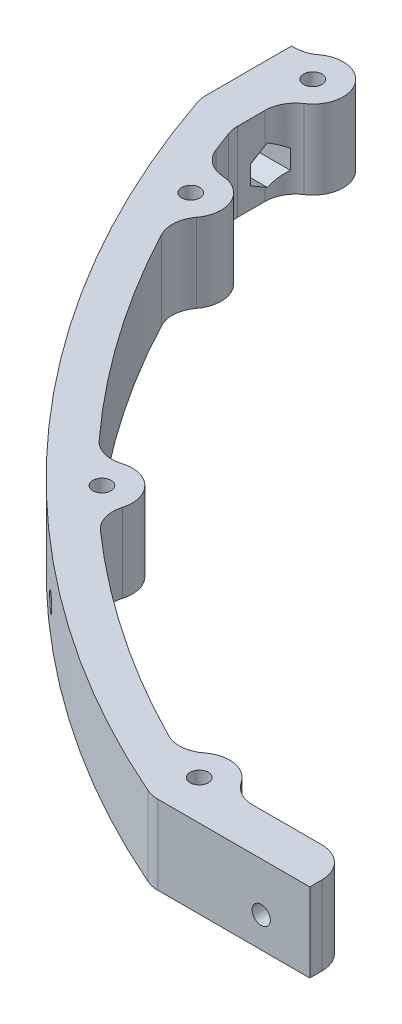
from build123d import *

# Parameters (mm, degrees)
BOSS_EXTRU_1_DEPTH           = 8
BOSS_EXTRU_1_DEPTH_BACK      = 5
ESQUISSE7_R                  = 1.5
ENL_V_MAT_EXTRU_5_DEPTH      = 231.204257128
ESQUISSE11_R                 = 1.5
ENL_V_MAT_EXTRU_9_DEPTH      = 231.204257128
ENL_V_MAT_EXTRU_10_DEPTH     = 231.204257128
ENL_V_MAT_EXTRU_11_DEPTH     = 229.086606358
ESQUISSE14_R                 = 5
ESQUISSE14_R_2               = 1.5
BOSS_EXTRU_2_DEPTH           = 13
CONG_1_R                     = 5
ESQUISSE15_R                 = 1.5
ENL_V_MAT_EXTRU_12_DEPTH     = 228.856314519
ESQUISSE16_R                 = 1.5
ENL_V_MAT_EXTRU_13_DEPTH     = 228.856314519
ESQUISSE17_R                 = 1.5
ENL_V_MAT_EXTRU_14_DEPTH     = 153.261440141
ENL_V_START                  = -3
ENL_V_MAT_EXTRU_15_DEPTH     = 150.261440141
R_P_TITION_CIRCULAIRE1_COUNT = 3
R_P_TITION_CIRCULAIRE1_ANGLE = 56
ENL_V_MAT_EXTRU_16_DEPTH     = 201.264606015
ENL_V_MAT_EXTRU_17_DEPTH     = 10
ENL_V_MAT_EXTRU_20_DEPTH     = 197.871208676


with BuildPart() as part:
    # Esquisse1 → Boss.-Extru.1 (new, two sides: drawn at the far end of the back side and taken through both)
    with BuildSketch(Plane(origin=(0, 0, 0), x_dir=(1, 0, 0), z_dir=(0, 1, 0)).offset(-BOSS_EXTRU_1_DEPTH_BACK)):
        with BuildLine():
            Line((0, 49), (165, 49))
            Line((165, 49), (165, -55.235857919))
            ThreePointArc((165, -55.235857919), (127.908511428, -117.963607542), (68.381283989, -160))
            Line((68.381283989, -160), (0, -160))
            Line((0, -160), (0, 49))
        make_face()
    extrude(amount=BOSS_EXTRU_1_DEPTH + BOSS_EXTRU_1_DEPTH_BACK)

    # Symétrie1: part across plane


with BuildPart() as part_1:
    add(part.part)
    add(part.part.mirror(Plane(origin=(0, -5, -49), x_dir=(0, 0, 1), z_dir=(-1, 0, 0))))

    # Esquisse7 → Enlèv. mat.-Extru.5 (cut, through all)
    with BuildSketch(Plane(origin=(0, 8, 0), x_dir=(1, 0, 0), z_dir=(0, 1, 0))):
        with Locations(Location((-157, -43, 0), (0, 0, 270))):
            Circle(ESQUISSE7_R)
        with Locations(Location((157, -43, 0), (0, 0, 270))):
            Circle(ESQUISSE7_R)
        with Locations(Location((157, 43, 0), (0, 0, 270))):
            Circle(ESQUISSE7_R)
        with Locations(Location((-157, 43, 0), (0, 0, 270))):
            Circle(ESQUISSE7_R)
        with Locations(Location((-114, 43, 0), (0, 0, 270))):
            Circle(ESQUISSE7_R)
        with Locations(Location((-90, 43, 0), (0, 0, 270))):
            Circle(ESQUISSE7_R)
        with Locations(Location((90, 43, 0), (0, 0, 90))):
            Circle(ESQUISSE7_R)
        with Locations(Location((114, 43, 0), (0, 0, 90))):
            Circle(ESQUISSE7_R)
    extrude(amount=-ENL_V_MAT_EXTRU_5_DEPTH, mode=Mode.SUBTRACT)

    # Esquisse11 → Enlèv. mat.-Extru.9 (cut, through all)
    with BuildSketch(Plane(origin=(0, 8, 0), x_dir=(1, 0, 0), z_dir=(0, 1, 0))):
        with Locations(Location((-150.869773386, -69.240966765, 0), (0, 0, 270))):
            Circle(ESQUISSE11_R)
        with Locations(Location((-116.399964779, -118.351375994, 0), (0, 0, 270))):
            Circle(ESQUISSE11_R)
        with Locations(Location((-66.72330927, -152, 0), (0, 0, 270))):
            Circle(ESQUISSE11_R)
        with Locations(Location((66.72330927, -152, 0), (0, 0, 90))):
            Circle(ESQUISSE11_R)
        with Locations(Location((116.399964779, -118.351375994, 0), (0, 0, 90))):
            Circle(ESQUISSE11_R)
        with Locations(Location((150.869773386, -69.240966765, 0), (0, 0, 90))):
            Circle(ESQUISSE11_R)
        with Locations(Location((-15, -152, 0), (0, 0, 270))):
            Circle(ESQUISSE11_R)
        with Locations(Location((15, -152, 0), (0, 0, 90))):
            Circle(ESQUISSE11_R)
    extrude(amount=-ENL_V_MAT_EXTRU_9_DEPTH, mode=Mode.SUBTRACT)

    # Esquisse12 → Enlèv. mat.-Extru.10 (cut, through all)
    with BuildSketch(Plane(origin=(0, 8, 0), x_dir=(1, 0, 0), z_dir=(0, 1, 0))):
        with BuildLine():
            Line((165, 49), (-165, 49))
            Line((-165, 49), (-165, -55.235857919))
            ThreePointArc((-165, -55.235857919), (-127.908511428, -117.963607542), (-68.381283989, -160))
            Line((-68.381283989, -160), (68.381283989, -160))
            ThreePointArc((68.381283989, -160), (127.908511428, -117.963607542), (165, -55.235857919))
            Line((165, -55.235857919), (165, 49))
        make_face()
        with BuildLine():
            Line((163.5, 47.5), (-163.5, 47.5))
            Line((-163.5, 47.5), (-163.5, -54.990908339))
            ThreePointArc((-163.5, -54.990908339), (-126.827060587, -116.923678966), (-68.0734897, -158.5))
            Line((-68.0734897, -158.5), (68.0734897, -158.5))
            ThreePointArc((68.0734897, -158.5), (126.827060587, -116.923678966), (163.5, -54.990908339))
            Line((163.5, -54.990908339), (163.5, 47.5))
        make_face(mode=Mode.SUBTRACT)
    extrude(amount=-ENL_V_MAT_EXTRU_10_DEPTH, mode=Mode.SUBTRACT)

    # Esquisse13 → Enlèv. mat.-Extru.11 (cut, through all)
    with BuildSketch(Plane(origin=(0, 8, 0), x_dir=(1, 0, 0), z_dir=(0, 1, 0))):
        with BuildLine():
            Line((-163.5, 47.5), (163.5, 47.5))
            Line((163.5, 47.5), (163.5, -158.5))
            Line((163.5, -158.5), (-42, -158.5))
            Line((-42, -158.5), (-42, -151.5))
            Line((-42, -151.5), (-69.065186599, -151.5))
            ThreePointArc((-69.065186599, -151.5), (-122.312588735, -112.968494001), (-156.5, -56.833088954))
            Line((-156.5, -56.833088954), (-156.5, -40))
            Line((-156.5, -40), (-163.5, -40))
            Line((-163.5, -40), (-163.5, 47.5))
        make_face()
    extrude(amount=-ENL_V_MAT_EXTRU_11_DEPTH, mode=Mode.SUBTRACT)

    # Esquisse14 → Boss.-Extru.2 (add)
    # profile 1 of 4: a face of its own
    with BuildSketch(Plane(origin=(0, 8, 0), x_dir=(1, 0, 0), z_dir=(0, 1, 0))):
        with Locations((-157, -43)):
            Circle(ESQUISSE14_R)
        with Locations(Location((-157, -43, 0), (0, 0, 270))):
            Circle(ESQUISSE14_R_2, mode=Mode.SUBTRACT)
    # profile 2 of 4: a face of its own
    with BuildSketch(Plane(origin=(0, 8, 0), x_dir=(1, 0, 0), z_dir=(0, 1, 0))):
        with Locations((-150.869773386, -69.240966765)):
            Circle(ESQUISSE14_R)
        with Locations(Location((-150.869773386, -69.240966765, 0), (0, 0, 270))):
            Circle(ESQUISSE14_R_2, mode=Mode.SUBTRACT)
    # profile 3 of 4: a face of its own
    with BuildSketch(Plane(origin=(0, 8, 0), x_dir=(1, 0, 0), z_dir=(0, 1, 0))):
        with Locations((-116.399964779, -118.351375994)):
            Circle(ESQUISSE14_R)
        with Locations(Location((-116.399964779, -118.351375994, 0), (0, 0, 270))):
            Circle(ESQUISSE14_R_2, mode=Mode.SUBTRACT)
    # profile 4 of 4: a face of its own
    with BuildSketch(Plane(origin=(0, 8, 0), x_dir=(1, 0, 0), z_dir=(0, 1, 0))):
        with Locations((-66.72330927, -152)):
            Circle(ESQUISSE14_R)
        with Locations(Location((-66.72330927, -152, 0), (0, 0, 270))):
            Circle(ESQUISSE14_R_2, mode=Mode.SUBTRACT)
    extrude(amount=-BOSS_EXTRU_2_DEPTH)

    # Congé1
    cong_1_edges = [part_1.edges().sort_by_distance(p)[0] for p in [
        (-68.0734897, 1.5, 158.5),
        (-163.5, 1.5, 54.990908339),
        (-156.5, 1.5, 56.833088954),
        (-42, 1.5, 151.5),
        (-156.5, 1.5, 47.974937186),
        (-161, 1.5, 40),
        (-153.334454405, 1.5, 64.890639482),
        (-149.178439568, 1.5, 73.946218078),
        (-113.146421745, 1.5, 122.148013681),
        (-120.250165346, 1.5, 115.161398629),
        (-71.456027426, 1.5, 150.38712094),
        (-61.748372085, 1.5, 151.5),
    ]]
    fillet(cong_1_edges, radius=CONG_1_R)

    # Esquisse15 → Enlèv. mat.-Extru.12 (cut, through all)
    with BuildSketch(Plane(origin=(0, 0, 0), x_dir=(0, 0, -1), z_dir=(1, 0, 0))):
        with Locations((-51, 0)):
            Circle(ESQUISSE15_R)
    extrude(amount=-ENL_V_MAT_EXTRU_12_DEPTH, mode=Mode.SUBTRACT)

    # Esquisse16 → Enlèv. mat.-Extru.13 (cut, through all)
    with BuildSketch(Plane.XY):
        with Locations((-50, 0)):
            Circle(ESQUISSE16_R)
    extrude(amount=ENL_V_MAT_EXTRU_13_DEPTH, mode=Mode.SUBTRACT)

    # Esquisse17 → Enlèv. mat.-Extru.14 (cut, through all)
    with BuildSketch(Plane(origin=(-160.497030477, 0, 63.22146161), x_dir=(0, 1, 0), z_dir=(-0.9304175679820242, 0, 0.3665012267242981))):
        with Locations(Location((0, 0, 0), (0, 0, 356.983675285))):
            Circle(ESQUISSE17_R)
    enl_v_mat_extru_14 = extrude(amount=-ENL_V_MAT_EXTRU_14_DEPTH, mode=Mode.SUBTRACT)

    # Esquisse18 → Enlèv. mat.-Extru.15 (cut, through all)
    with BuildSketch(Plane(origin=(-160.497030477, 0, 63.22146161), x_dir=(0, 1, 0), z_dir=(-0.9304175679820242, 0, 0.3665012267242981)).offset(ENL_V_START)):
        Polygon((3.175426481, 0), (1.58771324, 2.75), (-1.58771324, 2.75), (-3.175426481, 0), (-1.58771324, -2.75), (1.58771324, -2.75), align=None)
    enl_v_mat_extru_15 = extrude(amount=-ENL_V_MAT_EXTRU_15_DEPTH, mode=Mode.SUBTRACT)

    # Répétition circulaire1: Enlèv. mat.-Extru.14, Enlèv. mat.-Extru.15 ×3 about axis
    r_p_tition_circulaire1_axis = Axis((0, 0, 0), (0, 1, 0))
    add([enl_v_mat_extru_14.rotate(r_p_tition_circulaire1_axis, i * R_P_TITION_CIRCULAIRE1_ANGLE / (R_P_TITION_CIRCULAIRE1_COUNT - 1)) for i in range(1, R_P_TITION_CIRCULAIRE1_COUNT)], mode=Mode.SUBTRACT)
    add([enl_v_mat_extru_15.rotate(r_p_tition_circulaire1_axis, i * R_P_TITION_CIRCULAIRE1_ANGLE / (R_P_TITION_CIRCULAIRE1_COUNT - 1)) for i in range(1, R_P_TITION_CIRCULAIRE1_COUNT)], mode=Mode.SUBTRACT)

    # Esquisse19 → Enlèv. mat.-Extru.16 (cut, through all)
    with BuildSketch(Plane.XY.offset(158.5).offset(ENL_V_START)):
        Polygon((-47.25, -1.58771324), (-47.25, 1.58771324), (-50, 3.175426481), (-52.75, 1.58771324), (-52.75, -1.58771324), (-50, -3.175426481), align=None)
    extrude(amount=-ENL_V_MAT_EXTRU_16_DEPTH, mode=Mode.SUBTRACT)

    # Esquisse20 → Enlèv. mat.-Extru.17 (cut)
    with BuildSketch(Plane.XZ.offset(5)):
        Polygon((-63.97330927, 153.58771324), (-66.72330927, 155.175426481), (-69.47330927, 153.58771324), (-69.47330927, 150.41228676), (-66.72330927, 148.824573519), (-63.97330927, 150.41228676), align=None)
        Polygon((-115.603450188, 121.425281952), (-118.663788132, 120.578130843), (-119.460302723, 117.504224885), (-117.196479369, 115.277470035), (-114.136141425, 116.124621144), (-113.339626834, 119.198527102), align=None)
        Polygon((-151.218044196, 72.397236838), (-153.777318856, 70.517490432), (-153.429048045, 67.361220359), (-150.521502575, 66.084696692), (-147.962227916, 67.964443098), (-148.310498726, 71.120713171), align=None)
        Polygon((-158.58771324, 40.25), (-155.41228676, 40.25), (-153.824573519, 43), (-155.41228676, 45.75), (-158.58771324, 45.75), (-160.175426481, 43), align=None)
    extrude(amount=-ENL_V_MAT_EXTRU_17_DEPTH, mode=Mode.SUBTRACT)

    # Esquisse23 → Enlèv. mat.-Extru.20 (cut, through all)
    with BuildSketch(Plane.ZY.offset(163.5).offset(ENL_V_START)):
        Polygon((53.75, 1.58771324), (51, 3.175426481), (48.25, 1.58771324), (48.25, -1.58771324), (51, -3.175426481), (53.75, -1.58771324), align=None)
    extrude(amount=-ENL_V_MAT_EXTRU_20_DEPTH, mode=Mode.SUBTRACT)


solid = part_1.part
